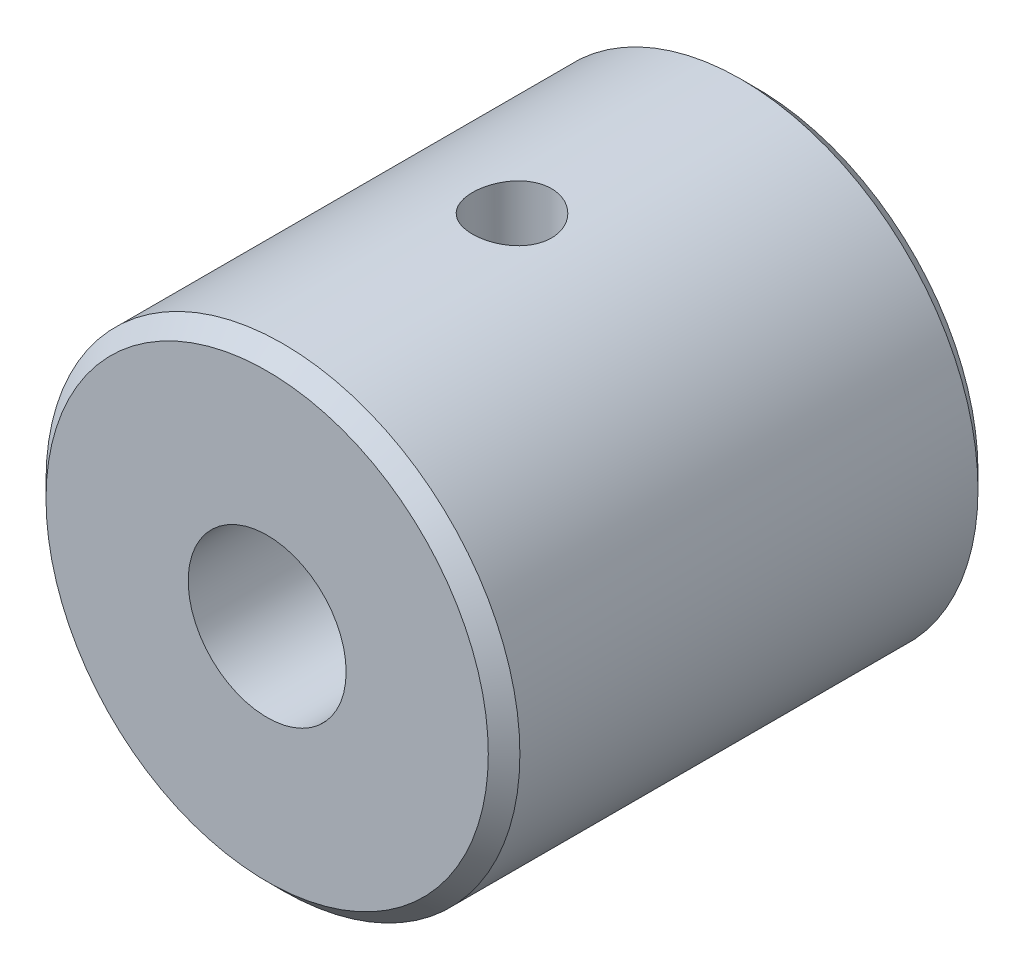
from build123d import *

# Parameters (mm, degrees)
SKETCH1_R               = 3.81
EXTRUDE1_DEPTH          = 3.937
CHAMFER1_SIZE           = 0.254
CUT_EXTRUDE1_DEPTH      = 7.673242765
CUT_EXTRUDE1_DEPTH_BACK = 7.673242765
SKETCH2_R               = 1.27
CUT_EXTRUDE2_DEPTH      = 7.673242765
CUT_EXTRUDE2_DEPTH_BACK = 7.673242765
SKETCH3_R               = 0.635


with BuildPart() as part:
    # Sketch1 → Extrude1 (new, symmetric)
    with BuildSketch(Plane.XY):
        Circle(SKETCH1_R)
    extrude(amount=EXTRUDE1_DEPTH, both=True)

    # Chamfer1
    chamfer1_edges = [part.edges().sort_by_distance(p)[0] for p in [
        (-3.81, 0, -3.937),
        (-3.81, 0, 3.937),
    ]]
    chamfer(chamfer1_edges, length=CHAMFER1_SIZE)

    # Sketch2 → Cut-Extrude1 (cut, two sides: drawn at the far end of the back side and taken through both)
    with BuildSketch(Plane.XY.offset(-CUT_EXTRUDE1_DEPTH_BACK)):
        Circle(SKETCH2_R)
    extrude(amount=CUT_EXTRUDE1_DEPTH + CUT_EXTRUDE1_DEPTH_BACK, mode=Mode.SUBTRACT)

    # Sketch3 → Cut-Extrude2 (cut, two sides: drawn at the far end of the back side and taken through both)
    with BuildSketch(Plane(origin=(0, 0, 0), x_dir=(1, 0, 0), z_dir=(0, 1, 0)).offset(-CUT_EXTRUDE2_DEPTH_BACK)):
        with Locations(Location((0, 0, 0), (0, 0, 270))):
            Circle(SKETCH3_R)
    extrude(amount=CUT_EXTRUDE2_DEPTH + CUT_EXTRUDE2_DEPTH_BACK, mode=Mode.SUBTRACT)


solid = part.part
